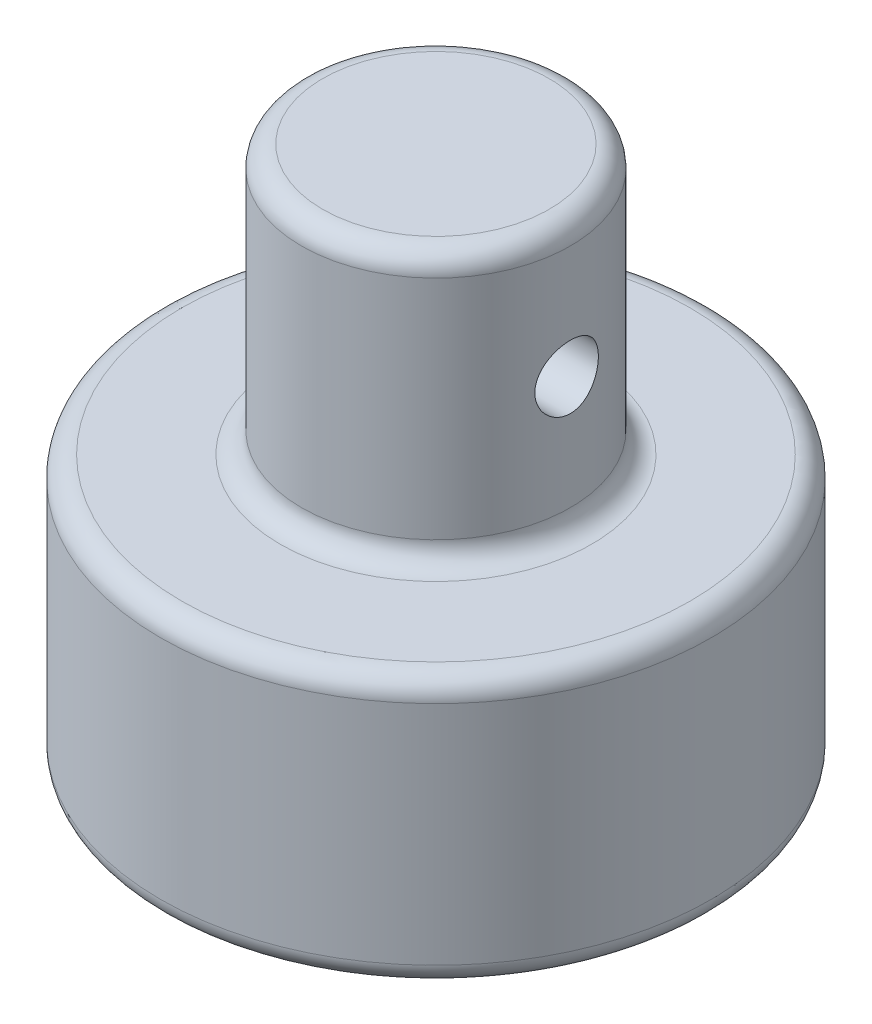
from build123d import *

# Parameters (mm, degrees)
SKETCH2_R               = 6.5
BOSS_EXTRUDE1_DEPTH     = 6.35
SKETCH3_R               = 3.175
BOSS_EXTRUDE2_DEPTH     = 6.35
CUT_EXTRUDE1_DEPTH      = 6.35
CUT_EXTRUDE1_DEPTH_BACK = 6.35
SKETCH4_R               = 0.75
FILLET1_R               = 0.5


with BuildPart() as part:
    # Sketch2 → Boss-Extrude1 (new body)
    with BuildSketch(Plane(origin=(0, 0, 0), x_dir=(1, 0, 0), z_dir=(0, 1, 0))):
        Circle(SKETCH2_R)
    extrude(amount=BOSS_EXTRUDE1_DEPTH)

    # Sketch3 → Boss-Extrude2 (add)
    with BuildSketch(Plane(origin=(0, 6.35, 0), x_dir=(1, 0, 0), z_dir=(0, 1, 0))):
        Circle(SKETCH3_R)
    extrude(amount=BOSS_EXTRUDE2_DEPTH)

    # Sketch4 → Cut-Extrude1 (cut, two sides: drawn at the far end of the back side and taken through both)
    with BuildSketch(Plane(origin=(0, 0, 0), x_dir=(0, 0, -1), z_dir=(1, 0, 0)).offset(-CUT_EXTRUDE1_DEPTH_BACK)):
        with Locations((0, 9.525)):
            Circle(SKETCH4_R)
    extrude(amount=CUT_EXTRUDE1_DEPTH + CUT_EXTRUDE1_DEPTH_BACK, mode=Mode.SUBTRACT)

    # Fillet1
    fillet1_edges = [part.edges().sort_by_distance(p)[0] for p in [
        (-6.5, 0, 0),
        (-3.175, 12.7, 0),
        (-6.5, 6.35, 0),
        (-3.175, 6.35, 0),
    ]]
    fillet(fillet1_edges, radius=FILLET1_R)


solid = part.part
